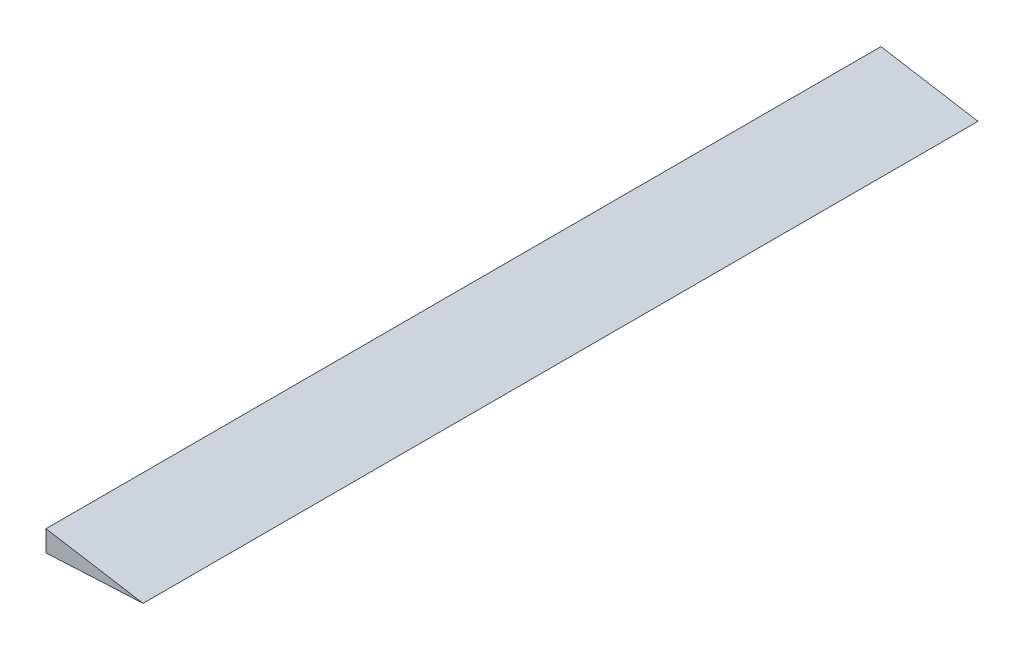
from build123d import *

# Parameters (mm, degrees)
BOSS_EXTRUDE2_DEPTH = 437.02224


with BuildPart() as part:
    # Sketch2 → Boss-Extrude2 (new body)
    with BuildSketch(Plane(origin=(0, 0, -761.999746), x_dir=(-1, 0, 0), z_dir=(0, 0, -1))):
        Polygon((-306.8495768, -2.516115741), (-306.8495768, 8.449856001), (-357.6495768, 0), align=None)
    extrude(amount=-BOSS_EXTRUDE2_DEPTH)


solid = part.part
